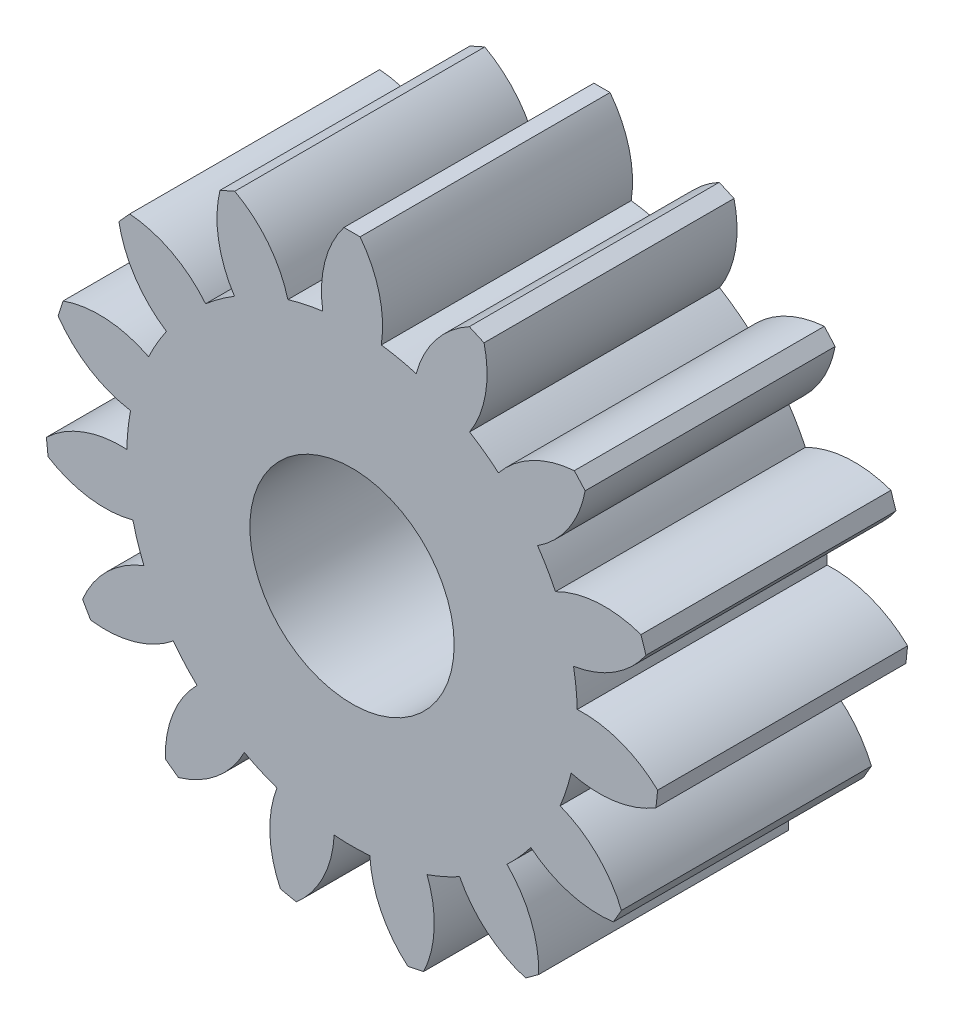
from build123d import *

# Parameters (mm, degrees)
ESBO_O1_R                = 9.374
RESSALTO_EXTRUS_O1_DEPTH = 10.4
RESSALTO_EXTRUS_O2_START = -10.4
RESSALTO_EXTRUS_O2_DEPTH = 10.4
PADR_OCIRCULAR1_COUNT    = 15
ESBO_O4_R                = 4.25
CORTE_EXTRUS_O1_DEPTH    = 10.4


with BuildPart() as part:
    # Esboço1 → Ressalto-extrusão1 (new body)
    with BuildSketch(Plane.XY):
        Circle(ESBO_O1_R)
    extrude(amount=RESSALTO_EXTRUS_O1_DEPTH)

    # Esboço2 → Ressalto-extrusão2 (add)
    with BuildSketch(Plane.XY.offset(10.4).offset(RESSALTO_EXTRUS_O2_START)):
        with BuildLine():
            Line((-0.337, 12.75), (0.337, 12.75))
            ThreePointArc((0.337, 12.75), (1.131844214, 11.112718069), (1.216843597, 9.294684915))
            ThreePointArc((1.216843597, 9.294684915), (0, 9.374), (-1.216843597, 9.294684915))
            ThreePointArc((-1.216843597, 9.294684915), (-1.131844214, 11.112718069), (-0.337, 12.75))
        make_face()
    ressalto_extrus_o2 = extrude(amount=RESSALTO_EXTRUS_O2_DEPTH)

    # PadrãoCircular1: Ressalto-extrusão2 ×15 about axis
    padr_ocircular1_axis = Axis((0, 0, 0), (0, 0, 1))
    for i in range(1, PADR_OCIRCULAR1_COUNT):
        add(ressalto_extrus_o2.rotate(padr_ocircular1_axis, i * 360 / PADR_OCIRCULAR1_COUNT))

    # Esboço4 → Corte-extrusão1 (cut)
    with BuildSketch(Plane.XY.offset(10.4)):
        Circle(ESBO_O4_R)
    extrude(amount=-CORTE_EXTRUS_O1_DEPTH, mode=Mode.SUBTRACT)


solid = part.part
